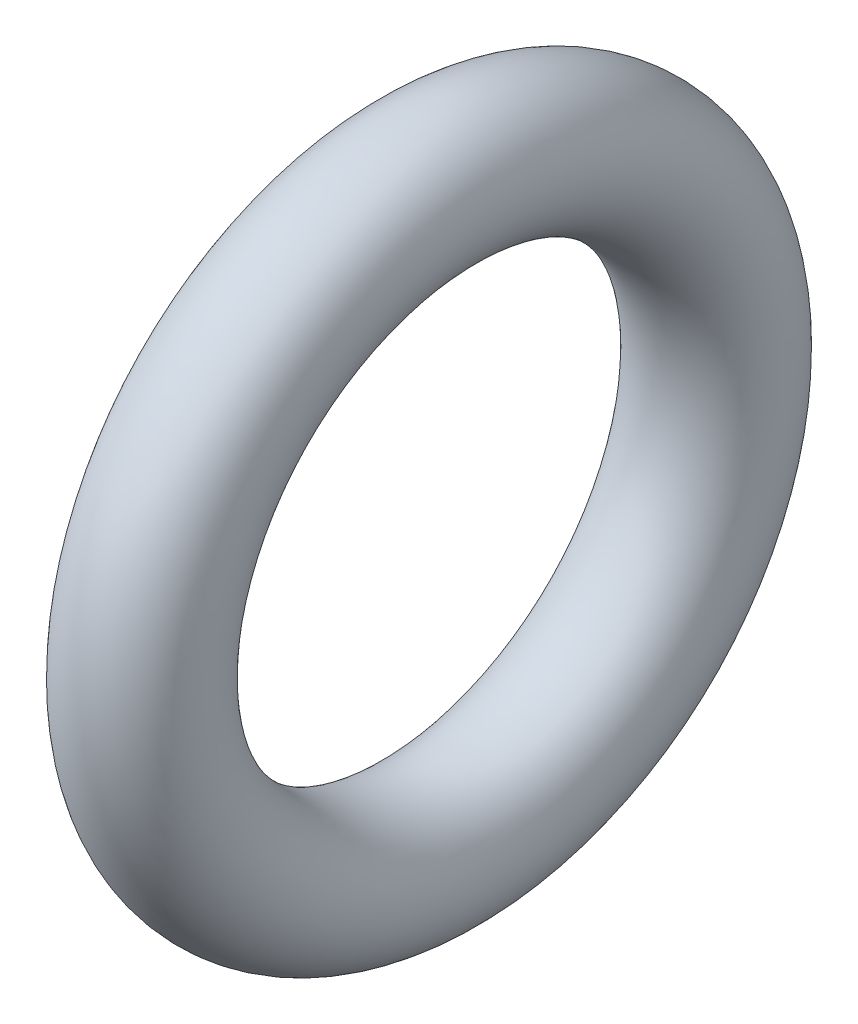
from build123d import *

# Parameters (mm, degrees)
SKETCH1_R = 0.7375


with BuildPart() as part:
    # Sketch1 → Revolve1 (revolve)
    with BuildSketch(Plane(origin=(0, 0, 0), x_dir=(1, 0, 0), z_dir=(0, 1, 0))):
        with Locations((-91.092288921, -3.447046529)):
            Circle(SKETCH1_R)
    revolve(axis=Axis((-95.444804608, 0, 0.309546529), (1, 0, 0)))


solid = part.part
